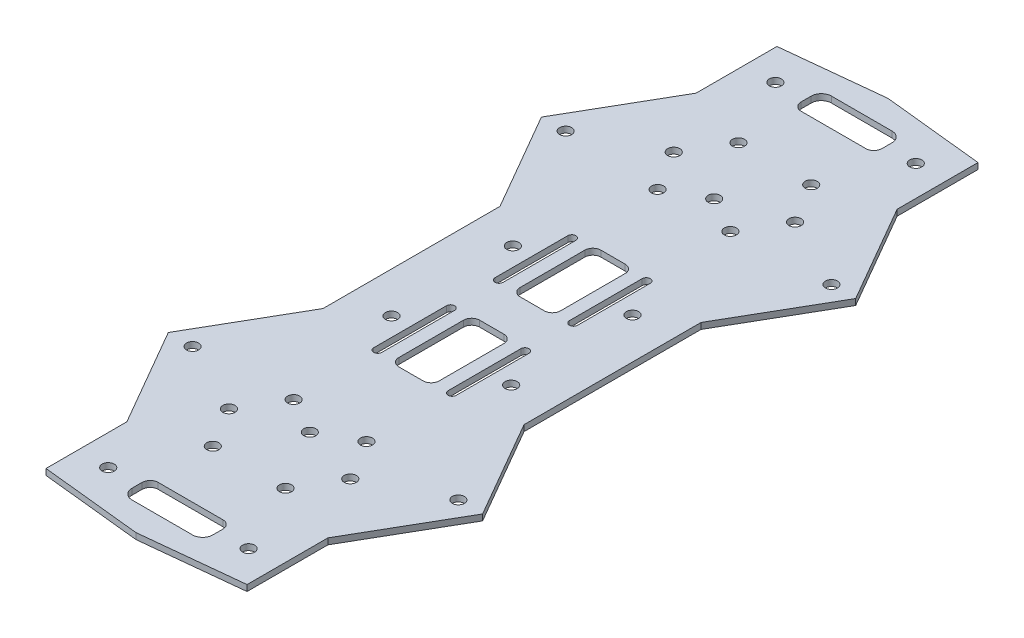
from build123d import *

# Parameters (mm, degrees)
SKETCH1_R           = 1.5
BOSS_EXTRUDE1_DEPTH = 1.5
CUT_EXTRUDE1_DEPTH  = 1.5


with BuildPart() as part:
    # Sketch1 → Boss-Extrude1 (new body)
    with BuildSketch(Plane(origin=(0, 0, 0), x_dir=(1, 0, 0), z_dir=(0, 1, 0))):
        Polygon((0, 93), (-24.863047384, 90.386788418), (-24.863047384, 70.386788418), (-38.863047384, 46.138077112), (-24.863047384, 21.889365806), (-24.863047384, -21.889365806), (-38.863047384, -46.138077112), (-24.863047384, -70.386788418), (-24.863047384, -90.386788418), (0, -93), (24.863047384, -90.386788418), (24.863047384, -70.386788418), (38.863047384, -46.138077112), (24.863047384, -21.889365806), (24.863047384, 21.889365806), (38.863047384, 46.138077112), (24.863047384, 70.386788418), (24.863047384, 90.386788418), align=None)
        with Locations(Location((0, 50, 0), (0, 0, 270))):
            Circle(SKETCH1_R, mode=Mode.SUBTRACT)
        with Locations(Location((-9, 45, 0), (0, 0, 270))):
            Circle(SKETCH1_R, mode=Mode.SUBTRACT)
        with Locations(Location((-15, 55, 0), (0, 0, 270))):
            Circle(SKETCH1_R, mode=Mode.SUBTRACT)
        with Locations(Location((-9, 65, 0), (0, 0, 270))):
            Circle(SKETCH1_R, mode=Mode.SUBTRACT)
        with Locations(Location((9, 45, 0), (0, 0, 90))):
            Circle(SKETCH1_R, mode=Mode.SUBTRACT)
        with Locations(Location((9, 65, 0), (0, 0, 90))):
            Circle(SKETCH1_R, mode=Mode.SUBTRACT)
        with Locations(Location((15, 55, 0), (0, 0, 90))):
            Circle(SKETCH1_R, mode=Mode.SUBTRACT)
        with Locations(Location((-14.8, 15, 0), (0, 0, 270))):
            Circle(SKETCH1_R, mode=Mode.SUBTRACT)
        with Locations(Location((14.8, 15, 0), (0, 0, 90))):
            Circle(SKETCH1_R, mode=Mode.SUBTRACT)
        with Locations(Location((-32.863047384, 46.138077112, 0), (0, 0, 270))):
            Circle(SKETCH1_R, mode=Mode.SUBTRACT)
        with Locations(Location((-17.363047384, 82.5, 0), (0, 0, 270))):
            Circle(SKETCH1_R, mode=Mode.SUBTRACT)
        with Locations(Location((32.863047384, 46.138077112, 0), (0, 0, 90))):
            Circle(SKETCH1_R, mode=Mode.SUBTRACT)
        with Locations(Location((17.363047384, 82.5, 0), (0, 0, 90))):
            Circle(SKETCH1_R, mode=Mode.SUBTRACT)
        with Locations(Location((-14.8, -15, 0), (0, 0, 90))):
            Circle(SKETCH1_R, mode=Mode.SUBTRACT)
        with Locations(Location((14.8, -15, 0), (0, 0, 270))):
            Circle(SKETCH1_R, mode=Mode.SUBTRACT)
        with Locations(Location((32.863047384, -46.138077112, 0), (0, 0, 270))):
            Circle(SKETCH1_R, mode=Mode.SUBTRACT)
        with Locations(Location((9, -45, 0), (0, 0, 270))):
            Circle(SKETCH1_R, mode=Mode.SUBTRACT)
        with Locations(Location((-32.863047384, -46.138077112, 0), (0, 0, 90))):
            Circle(SKETCH1_R, mode=Mode.SUBTRACT)
        with Locations(Location((-9, -45, 0), (0, 0, 90))):
            Circle(SKETCH1_R, mode=Mode.SUBTRACT)
        with Locations(Location((15, -55, 0), (0, 0, 270))):
            Circle(SKETCH1_R, mode=Mode.SUBTRACT)
        with Locations(Location((0, -50, 0), (0, 0, 90))):
            Circle(SKETCH1_R, mode=Mode.SUBTRACT)
        with Locations(Location((-15, -55, 0), (0, 0, 90))):
            Circle(SKETCH1_R, mode=Mode.SUBTRACT)
        with Locations(Location((-9, -65, 0), (0, 0, 90))):
            Circle(SKETCH1_R, mode=Mode.SUBTRACT)
        with Locations(Location((9, -65, 0), (0, 0, 270))):
            Circle(SKETCH1_R, mode=Mode.SUBTRACT)
        with Locations(Location((17.363047384, -82.5, 0), (0, 0, 270))):
            Circle(SKETCH1_R, mode=Mode.SUBTRACT)
        with Locations(Location((-17.363047384, -82.5, 0), (0, 0, 90))):
            Circle(SKETCH1_R, mode=Mode.SUBTRACT)
        with BuildLine():
            Line((-3, 5), (3, 5))
            ThreePointArc((3, 5), (4.414213562, 5.585786438), (5, 7))
            Line((5, 7), (5, 23))
            ThreePointArc((5, 23), (4.414213562, 24.414213562), (3, 25))
            Line((3, 25), (-3, 25))
            ThreePointArc((-3, 25), (-4.414213562, 24.414213562), (-5, 23))
            Line((-5, 23), (-5, 7))
            ThreePointArc((-5, 7), (-4.414213562, 5.585786438), (-3, 5))
        make_face(mode=Mode.SUBTRACT)
        with BuildLine():
            Line((-10.2, 6), (-10.2, 24))
            ThreePointArc((-10.2, 24), (-9.2, 25), (-8.2, 24))
            Line((-8.2, 24), (-8.2, 6))
            ThreePointArc((-8.2, 6), (-9.2, 5), (-10.2, 6))
        make_face(mode=Mode.SUBTRACT)
        with BuildLine():
            Line((10.2, 6), (10.2, 24))
            ThreePointArc((10.2, 24), (9.2, 25), (8.2, 24))
            Line((8.2, 24), (8.2, 6))
            ThreePointArc((8.2, 6), (9.2, 5), (10.2, 6))
        make_face(mode=Mode.SUBTRACT)
        with BuildLine():
            Line((5, -7), (5, -23))
            ThreePointArc((5, -23), (4.414213562, -24.414213562), (3, -25))
            Line((3, -25), (-3, -25))
            ThreePointArc((-3, -25), (-4.414213562, -24.414213562), (-5, -23))
            Line((-5, -23), (-5, -7))
            ThreePointArc((-5, -7), (-4.414213562, -5.585786438), (-3, -5))
            Line((-3, -5), (3, -5))
            ThreePointArc((3, -5), (4.414213562, -5.585786438), (5, -7))
        make_face(mode=Mode.SUBTRACT)
        with BuildLine():
            Line((10.2, -6), (10.2, -24))
            ThreePointArc((10.2, -24), (9.2, -25), (8.2, -24))
            Line((8.2, -24), (8.2, -6))
            ThreePointArc((8.2, -6), (9.2, -5), (10.2, -6))
        make_face(mode=Mode.SUBTRACT)
        with BuildLine():
            Line((-10.2, -6), (-10.2, -24))
            ThreePointArc((-10.2, -24), (-9.2, -25), (-8.2, -24))
            Line((-8.2, -24), (-8.2, -6))
            ThreePointArc((-8.2, -6), (-9.2, -5), (-10.2, -6))
        make_face(mode=Mode.SUBTRACT)
    extrude(amount=BOSS_EXTRUDE1_DEPTH)

    # Sketch2 → Cut-Extrude1 (cut)
    with BuildSketch(Plane(origin=(0, 1.5, 0), x_dir=(1, 0, 0), z_dir=(0, 1, 0))):
        with BuildLine():
            Line((-8, 79.5), (8, 79.5))
            ThreePointArc((8, 79.5), (9.414213562, 80.085786438), (10, 81.5))
            Line((10, 81.5), (10, 84))
            ThreePointArc((10, 84), (9.267766953, 85.767766953), (7.5, 86.5))
            Line((7.5, 86.5), (-7.5, 86.5))
            ThreePointArc((-7.5, 86.5), (-9.267766953, 85.767766953), (-10, 84))
            Line((-10, 84), (-10, 81.5))
            ThreePointArc((-10, 81.5), (-9.414213562, 80.085786438), (-8, 79.5))
        make_face()
        with BuildLine():
            Line((10, -81.5), (10, -84))
            ThreePointArc((10, -84), (9.267766953, -85.767766953), (7.5, -86.5))
            Line((7.5, -86.5), (-7.5, -86.5))
            ThreePointArc((-7.5, -86.5), (-9.267766953, -85.767766953), (-10, -84))
            Line((-10, -84), (-10, -81.5))
            ThreePointArc((-10, -81.5), (-9.414213562, -80.085786438), (-8, -79.5))
            Line((-8, -79.5), (8, -79.5))
            ThreePointArc((8, -79.5), (9.414213562, -80.085786438), (10, -81.5))
        make_face()
    extrude(amount=-CUT_EXTRUDE1_DEPTH, mode=Mode.SUBTRACT)


solid = part.part
